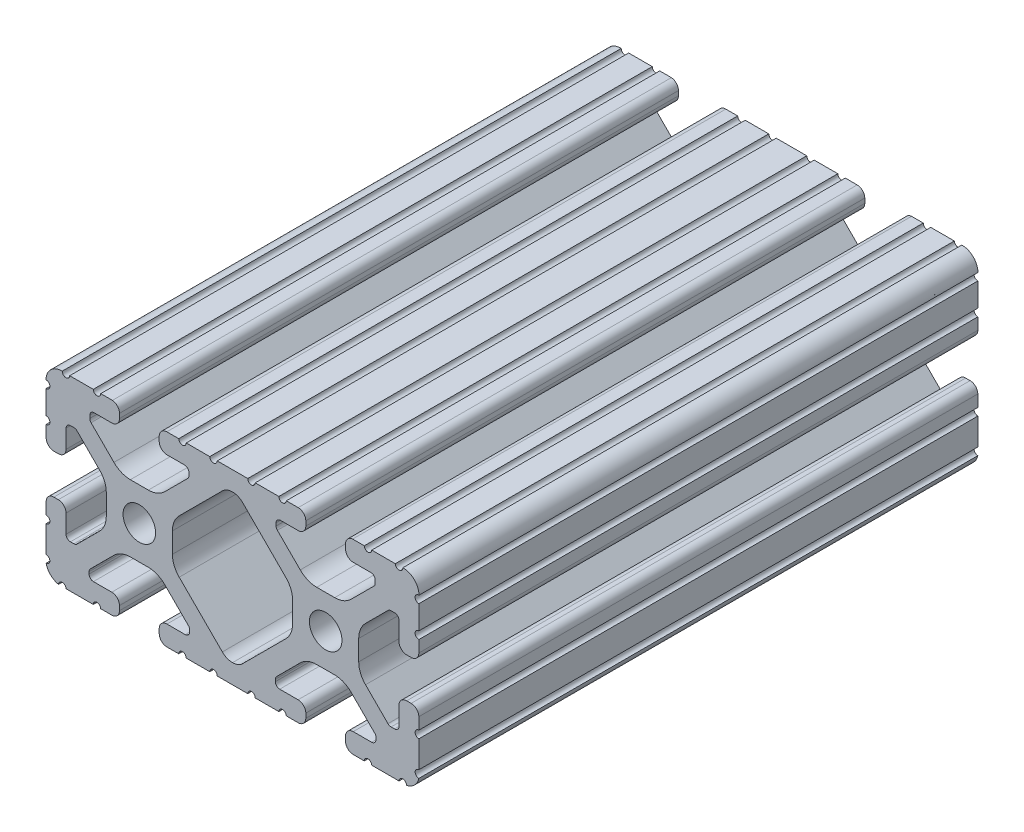
from build123d import *

# Parameters (mm, degrees)
SKETCH1_R      = 3.3274
EXTRUDE1_DEPTH = 114.3


with BuildPart() as part:
    # Sketch1 → Extrude1 (new body)
    with BuildSketch(Plane.XY):
        with BuildLine():
            Line((-3.121121376, -19.05), (3.121121376, -19.05))
            ThreePointArc((3.121121376, -19.05), (3.883121376, -18.288), (4.645121376, -19.05))
            Line((4.645121376, -19.05), (8.633115796, -19.05))
            Line((8.633115796, -19.05), (9.473536067, -19.05))
            ThreePointArc((9.473536067, -19.05), (10.235536067, -18.288), (10.997536067, -19.05))
            Line((10.997536067, -19.05), (13.4112, -19.05))
            ThreePointArc((13.4112, -19.05), (14.524751759, -18.588751759), (14.986, -17.4752))
            Line((14.986, -17.4752), (14.986, -16.5608))
            ThreePointArc((14.986, -16.5608), (14.524751759, -15.447248241), (13.4112, -14.986))
            Line((13.4112, -14.986), (9.652, -14.986))
            ThreePointArc((9.652, -14.986), (9.023382072, -14.725617928), (8.763, -14.097))
            Line((8.763, -14.097), (8.763, -13.687179678))
            ThreePointArc((8.763, -13.687179678), (8.830670671, -13.346975131), (9.023380503, -13.058563318))
            Line((9.023380503, -13.058563318), (13.852498595, -8.229421131))
            ThreePointArc((13.852498595, -8.229421131), (15.393447522, -7.199787805), (17.211122763, -6.838228541))
            Line((17.211122763, -6.838228541), (20.888877237, -6.838228541))
            ThreePointArc((20.888877237, -6.838228541), (22.706552478, -7.199787805), (24.247501405, -8.229421131))
            Line((24.247501405, -8.229421131), (29.076619497, -13.058563318))
            ThreePointArc((29.076619497, -13.058563318), (29.269329329, -13.346975131), (29.337, -13.687179678))
            Line((29.337, -13.687179678), (29.337, -14.097))
            ThreePointArc((29.337, -14.097), (29.076617928, -14.725617928), (28.448, -14.986))
            Line((28.448, -14.986), (24.6888, -14.986))
            ThreePointArc((24.6888, -14.986), (23.575248241, -15.447248241), (23.114, -16.5608))
            Line((23.114, -16.5608), (23.114, -17.4752))
            ThreePointArc((23.114, -17.4752), (23.575248241, -18.588751759), (24.6888, -19.05))
            Line((24.6888, -19.05), (26.945817469, -19.05))
            ThreePointArc((26.945817469, -19.05), (27.707817469, -18.288), (28.469817469, -19.05))
            Line((28.469817469, -19.05), (29.207115796, -19.05))
            Line((29.207115796, -19.05), (34.047273398, -19.05))
            ThreePointArc((34.047273398, -19.05), (34.809273398, -18.288), (35.571273398, -19.05))
            ThreePointArc((35.571273398, -19.05), (37.207577603, -18.182738167), (38.1, -16.560019212))
            ThreePointArc((38.1, -16.560019212), (37.338, -15.798019212), (38.1, -15.036019212))
            Line((38.1, -15.036019212), (38.1, -10.287))
            Line((38.1, -10.287), (38.1, -9.549701672))
            ThreePointArc((38.1, -9.549701672), (37.338, -8.787701672), (38.1, -8.025701672))
            Line((38.1, -8.025701672), (38.1, -5.6388))
            ThreePointArc((38.1, -5.6388), (37.638751759, -4.525248241), (36.5252, -4.064))
            Line((36.5252, -4.064), (35.6108, -4.064))
            ThreePointArc((35.6108, -4.064), (34.497248241, -4.525248241), (34.036, -5.6388))
            Line((34.036, -5.6388), (34.036, -9.398))
            ThreePointArc((34.036, -9.398), (33.775617928, -10.026617928), (33.147, -10.287))
            Line((33.147, -10.287), (32.420656743, -10.287))
            ThreePointArc((32.420656743, -10.287), (32.080450147, -10.21932848), (31.792037247, -10.02661636))
            Line((31.792037247, -10.02661636), (27.197575832, -5.43213202))
            ThreePointArc((27.197575832, -5.43213202), (26.167954729, -3.891188903), (25.8064, -2.07352461))
            Line((25.8064, -2.07352461), (25.8064, 2.07352461))
            ThreePointArc((25.8064, 2.07352461), (26.167954729, 3.891188903), (27.197575832, 5.43213202))
            Line((27.197575832, 5.43213202), (31.792037247, 10.02661636))
            ThreePointArc((31.792037247, 10.02661636), (32.080450147, 10.21932848), (32.420656743, 10.287))
            Line((32.420656743, 10.287), (33.147, 10.287))
            ThreePointArc((33.147, 10.287), (33.775617928, 10.026617928), (34.036, 9.398))
            Line((34.036, 9.398), (34.036, 5.6388))
            ThreePointArc((34.036, 5.6388), (34.497248241, 4.525248241), (35.6108, 4.064))
            Line((35.6108, 4.064), (36.5252, 4.064))
            ThreePointArc((36.5252, 4.064), (37.638751759, 4.525248241), (38.1, 5.6388))
            Line((38.1, 5.6388), (38.1, 8.025701672))
            ThreePointArc((38.1, 8.025701672), (37.338, 8.787701672), (38.1, 9.549701672))
            Line((38.1, 9.549701672), (38.1, 10.287))
            Line((38.1, 10.287), (38.1, 14.375206214))
            ThreePointArc((38.1, 14.375206214), (37.338232276, 15.156019383), (38.137614868, 15.89827725))
            ThreePointArc((38.137614868, 15.89827725), (37.148019028, 18.192014021), (34.819536496, 19.096833012))
            ThreePointArc((34.819536496, 19.096833012), (34.081312886, 18.311776389), (33.296256263, 19.05))
            Line((33.296256263, 19.05), (29.207115796, 19.05))
            Line((29.207115796, 19.05), (28.469817468, 19.05))
            ThreePointArc((28.469817468, 19.05), (27.707817468, 18.288), (26.945817468, 19.05))
            Line((26.945817468, 19.05), (24.558915796, 19.05))
            ThreePointArc((24.558915796, 19.05), (23.53023695, 18.547208069), (23.114, 17.480565346))
            Line((23.114, 17.480565346), (23.114, 16.5608))
            ThreePointArc((23.114, 16.5608), (23.575248241, 15.447248241), (24.6888, 14.986))
            Line((24.6888, 14.986), (28.295243665, 14.986))
            ThreePointArc((28.295243665, 14.986), (28.923861593, 14.725617928), (29.184243665, 14.097))
            Line((29.184243665, 14.097), (29.184243665, 13.53442258))
            ThreePointArc((29.184243665, 13.53442258), (29.116572993, 13.194218033), (28.923863161, 12.90580622))
            Line((28.923863161, 12.90580622), (24.247501405, 8.229421131))
            ThreePointArc((24.247501405, 8.229421131), (22.706552478, 7.199787805), (20.888877237, 6.838228541))
            Line((20.888877237, 6.838228541), (17.211122763, 6.838228541))
            ThreePointArc((17.211122763, 6.838228541), (15.393447522, 7.199787805), (13.852498595, 8.229421131))
            Line((13.852498595, 8.229421131), (9.176136839, 12.90580622))
            ThreePointArc((9.176136839, 12.90580622), (8.983427007, 13.194218033), (8.915756335, 13.53442258))
            Line((8.915756335, 13.53442258), (8.915756335, 14.097))
            ThreePointArc((8.915756335, 14.097), (9.176138407, 14.725617928), (9.804756335, 14.986))
            Line((9.804756335, 14.986), (13.4112, 14.986))
            ThreePointArc((13.4112, 14.986), (14.524751759, 15.447248241), (14.986, 16.5608))
            Line((14.986, 16.5608), (14.986, 17.496772581))
            ThreePointArc((14.986, 17.496772581), (14.531070222, 18.595070222), (13.432772581, 19.05))
            Line((13.432772581, 19.05), (10.997536067, 19.05))
            ThreePointArc((10.997536067, 19.05), (10.235536067, 18.288), (9.473536067, 19.05))
            Line((9.473536067, 19.05), (8.633115796, 19.05))
            Line((8.633115796, 19.05), (4.645121376, 19.05))
            ThreePointArc((4.645121376, 19.05), (3.883121376, 18.288), (3.121121376, 19.05))
            Line((3.121121376, 19.05), (-3.121121376, 19.05))
            ThreePointArc((-3.121121376, 19.05), (-3.883121376, 18.288), (-4.645121376, 19.05))
            Line((-4.645121376, 19.05), (-8.633115796, 19.05))
            Line((-8.633115796, 19.05), (-9.473536067, 19.05))
            ThreePointArc((-9.473536067, 19.05), (-10.235536067, 18.288), (-10.997536067, 19.05))
            Line((-10.997536067, 19.05), (-13.432772581, 19.05))
            ThreePointArc((-13.432772581, 19.05), (-14.531070222, 18.595070222), (-14.986, 17.496772581))
            Line((-14.986, 17.496772581), (-14.986, 16.5608))
            ThreePointArc((-14.986, 16.5608), (-14.524751759, 15.447248241), (-13.4112, 14.986))
            Line((-13.4112, 14.986), (-9.804756335, 14.986))
            ThreePointArc((-9.804756335, 14.986), (-9.176138407, 14.725617928), (-8.915756335, 14.097))
            Line((-8.915756335, 14.097), (-8.915756335, 13.53442258))
            ThreePointArc((-8.915756335, 13.53442258), (-8.983427007, 13.194218033), (-9.176136839, 12.90580622))
            Line((-9.176136839, 12.90580622), (-13.852498595, 8.229421131))
            ThreePointArc((-13.852498595, 8.229421131), (-15.393447522, 7.199787805), (-17.211122763, 6.838228541))
            Line((-17.211122763, 6.838228541), (-20.888877237, 6.838228541))
            ThreePointArc((-20.888877237, 6.838228541), (-22.706552478, 7.199787805), (-24.247501405, 8.229421131))
            Line((-24.247501405, 8.229421131), (-28.923863161, 12.90580622))
            ThreePointArc((-28.923863161, 12.90580622), (-29.116572993, 13.194218033), (-29.184243665, 13.53442258))
            Line((-29.184243665, 13.53442258), (-29.184243665, 14.097))
            ThreePointArc((-29.184243665, 14.097), (-28.923861593, 14.725617928), (-28.295243665, 14.986))
            Line((-28.295243665, 14.986), (-24.6888, 14.986))
            ThreePointArc((-24.6888, 14.986), (-23.575248241, 15.447248241), (-23.114, 16.5608))
            Line((-23.114, 16.5608), (-23.114, 17.480565346))
            ThreePointArc((-23.114, 17.480565346), (-23.53023695, 18.547208069), (-24.558915796, 19.05))
            Line((-24.558915796, 19.05), (-26.945817468, 19.05))
            ThreePointArc((-26.945817468, 19.05), (-27.707817468, 18.288), (-28.469817468, 19.05))
            Line((-28.469817468, 19.05), (-29.207115796, 19.05))
            Line((-29.207115796, 19.05), (-33.296256263, 19.05))
            ThreePointArc((-33.296256263, 19.05), (-34.081312886, 18.311776389), (-34.819536496, 19.096833012))
            ThreePointArc((-34.819536496, 19.096833012), (-37.148019028, 18.192014021), (-38.137614868, 15.89827725))
            ThreePointArc((-38.137614868, 15.89827725), (-37.338232276, 15.156019383), (-38.1, 14.375206214))
            Line((-38.1, 14.375206214), (-38.1, 10.287))
            Line((-38.1, 10.287), (-38.1, 9.549701672))
            ThreePointArc((-38.1, 9.549701672), (-37.338, 8.787701672), (-38.1, 8.025701672))
            Line((-38.1, 8.025701672), (-38.1, 5.6388))
            ThreePointArc((-38.1, 5.6388), (-37.638751759, 4.525248241), (-36.5252, 4.064))
            Line((-36.5252, 4.064), (-35.6108, 4.064))
            ThreePointArc((-35.6108, 4.064), (-34.497248241, 4.525248241), (-34.036, 5.6388))
            Line((-34.036, 5.6388), (-34.036, 9.398))
            ThreePointArc((-34.036, 9.398), (-33.775617928, 10.026617928), (-33.147, 10.287))
            Line((-33.147, 10.287), (-32.420656743, 10.287))
            ThreePointArc((-32.420656743, 10.287), (-32.080450147, 10.21932848), (-31.792037247, 10.02661636))
            Line((-31.792037247, 10.02661636), (-27.197575832, 5.43213202))
            ThreePointArc((-27.197575832, 5.43213202), (-26.167954729, 3.891188903), (-25.8064, 2.07352461))
            Line((-25.8064, 2.07352461), (-25.8064, -2.07352461))
            ThreePointArc((-25.8064, -2.07352461), (-26.167954729, -3.891188903), (-27.197575832, -5.43213202))
            Line((-27.197575832, -5.43213202), (-31.792037247, -10.02661636))
            ThreePointArc((-31.792037247, -10.02661636), (-32.080450147, -10.21932848), (-32.420656743, -10.287))
            Line((-32.420656743, -10.287), (-33.147, -10.287))
            ThreePointArc((-33.147, -10.287), (-33.775617928, -10.026617928), (-34.036, -9.398))
            Line((-34.036, -9.398), (-34.036, -5.6388))
            ThreePointArc((-34.036, -5.6388), (-34.497248241, -4.525248241), (-35.6108, -4.064))
            Line((-35.6108, -4.064), (-36.5252, -4.064))
            ThreePointArc((-36.5252, -4.064), (-37.638751759, -4.525248241), (-38.1, -5.6388))
            Line((-38.1, -5.6388), (-38.1, -8.025701672))
            ThreePointArc((-38.1, -8.025701672), (-37.338, -8.787701672), (-38.1, -9.549701672))
            Line((-38.1, -9.549701672), (-38.1, -10.287))
            Line((-38.1, -10.287), (-38.1, -15.036019212))
            ThreePointArc((-38.1, -15.036019212), (-37.338, -15.798019212), (-38.1, -16.560019212))
            ThreePointArc((-38.1, -16.560019212), (-37.20882252, -18.184002456), (-35.571273398, -19.05))
            ThreePointArc((-35.571273398, -19.05), (-34.809273398, -18.288), (-34.047273398, -19.05))
            Line((-34.047273398, -19.05), (-29.207115796, -19.05))
            Line((-29.207115796, -19.05), (-28.469817469, -19.05))
            ThreePointArc((-28.469817469, -19.05), (-27.707817469, -18.288), (-26.945817469, -19.05))
            Line((-26.945817469, -19.05), (-24.6888, -19.05))
            ThreePointArc((-24.6888, -19.05), (-23.575248241, -18.588751759), (-23.114, -17.4752))
            Line((-23.114, -17.4752), (-23.114, -16.5608))
            ThreePointArc((-23.114, -16.5608), (-23.575248241, -15.447248241), (-24.6888, -14.986))
            Line((-24.6888, -14.986), (-28.448, -14.986))
            ThreePointArc((-28.448, -14.986), (-29.076617928, -14.725617928), (-29.337, -14.097))
            Line((-29.337, -14.097), (-29.337, -13.687179678))
            ThreePointArc((-29.337, -13.687179678), (-29.269329329, -13.346975131), (-29.076619497, -13.058563318))
            Line((-29.076619497, -13.058563318), (-24.247501405, -8.229421131))
            ThreePointArc((-24.247501405, -8.229421131), (-22.706552478, -7.199787805), (-20.888877237, -6.838228541))
            Line((-20.888877237, -6.838228541), (-17.211122763, -6.838228541))
            ThreePointArc((-17.211122763, -6.838228541), (-15.393447522, -7.199787805), (-13.852498595, -8.229421131))
            Line((-13.852498595, -8.229421131), (-9.023380503, -13.058563318))
            ThreePointArc((-9.023380503, -13.058563318), (-8.830670671, -13.346975131), (-8.763, -13.687179678))
            Line((-8.763, -13.687179678), (-8.763, -14.097))
            ThreePointArc((-8.763, -14.097), (-9.023382072, -14.725617928), (-9.652, -14.986))
            Line((-9.652, -14.986), (-13.4112, -14.986))
            ThreePointArc((-13.4112, -14.986), (-14.524751759, -15.447248241), (-14.986, -16.5608))
            Line((-14.986, -16.5608), (-14.986, -17.4752))
            ThreePointArc((-14.986, -17.4752), (-14.524751759, -18.588751759), (-13.4112, -19.05))
            Line((-13.4112, -19.05), (-10.997536067, -19.05))
            ThreePointArc((-10.997536067, -19.05), (-10.235536067, -18.288), (-9.473536067, -19.05))
            Line((-9.473536067, -19.05), (-8.633115796, -19.05))
            Line((-8.633115796, -19.05), (-4.645121376, -19.05))
            ThreePointArc((-4.645121376, -19.05), (-3.883121376, -18.288), (-3.121121376, -19.05))
        make_face()
        with Locations((19.05, 0)):
            Circle(SKETCH1_R, mode=Mode.SUBTRACT)
        with Locations(Location((-19.05, 0, 0), (0, 0, 180))):
            Circle(SKETCH1_R, mode=Mode.SUBTRACT)
        with BuildLine():
            Line((2.077035361, 14.257564863), (10.902424168, 5.43213202))
            ThreePointArc((10.902424168, 5.43213202), (11.932045271, 3.891188903), (12.2936, 2.07352461))
            Line((12.2936, 2.07352461), (12.2936, -2.07352461))
            ThreePointArc((12.2936, -2.07352461), (11.932045271, -3.891188903), (10.902424168, -5.43213202))
            Line((10.902424168, -5.43213202), (2.077035361, -14.257564863))
            ThreePointArc((2.077035361, -14.257564863), (1.124045601, -14.892973012), (0, -15.113096807))
            ThreePointArc((0, -15.113096807), (-1.124045601, -14.892973012), (-2.077035361, -14.257564863))
            Line((-2.077035361, -14.257564863), (-10.902424168, -5.43213202))
            ThreePointArc((-10.902424168, -5.43213202), (-11.932045271, -3.891188903), (-12.2936, -2.07352461))
            Line((-12.2936, -2.07352461), (-12.2936, 2.07352461))
            ThreePointArc((-12.2936, 2.07352461), (-11.932045271, 3.891188903), (-10.902424168, 5.43213202))
            Line((-10.902424168, 5.43213202), (-2.077035361, 14.257564863))
            ThreePointArc((-2.077035361, 14.257564863), (-1.124045601, 14.892973012), (0, 15.113096807))
            ThreePointArc((0, 15.113096807), (1.124045601, 14.892973012), (2.077035361, 14.257564863))
        make_face(mode=Mode.SUBTRACT)
    extrude(amount=-EXTRUDE1_DEPTH)


solid = part.part
